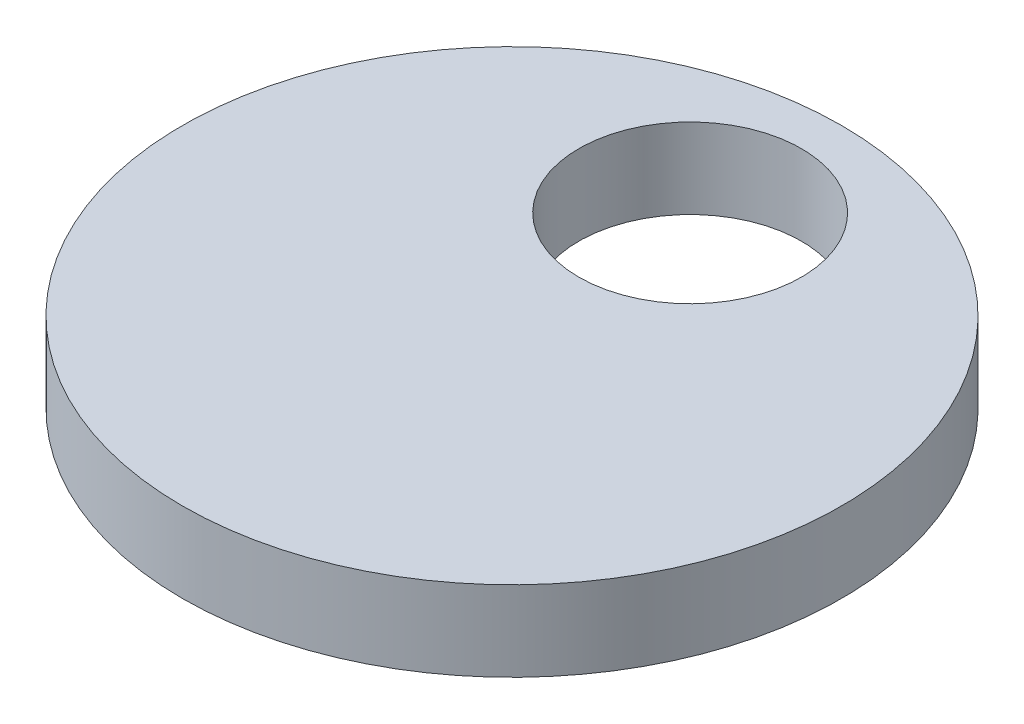
from build123d import *

# Parameters (mm, degrees)
SKETCH1_R           = 7.4
BOSS_EXTRUDE1_DEPTH = 1.8
SKETCH2_R           = 2.5
CUT_EXTRUDE1_DEPTH  = 1.8


with BuildPart() as part:
    # Sketch1 → Boss-Extrude1 (new body)
    with BuildSketch(Plane(origin=(0, 0, 0), x_dir=(1, 0, 0), z_dir=(0, 1, 0))):
        with Locations(Location((0, 0, 0), (0, 0, 270))):
            Circle(SKETCH1_R)
    extrude(amount=BOSS_EXTRUDE1_DEPTH)

    # Sketch2 → Cut-Extrude1 (cut)
    with BuildSketch(Plane(origin=(0, 1.8, 0), x_dir=(1, 0, 0), z_dir=(0, 1, 0))):
        with Locations(Location((0, 4, 0), (0, 0, 270))):
            Circle(SKETCH2_R)
    extrude(amount=-CUT_EXTRUDE1_DEPTH, mode=Mode.SUBTRACT)


solid = part.part
